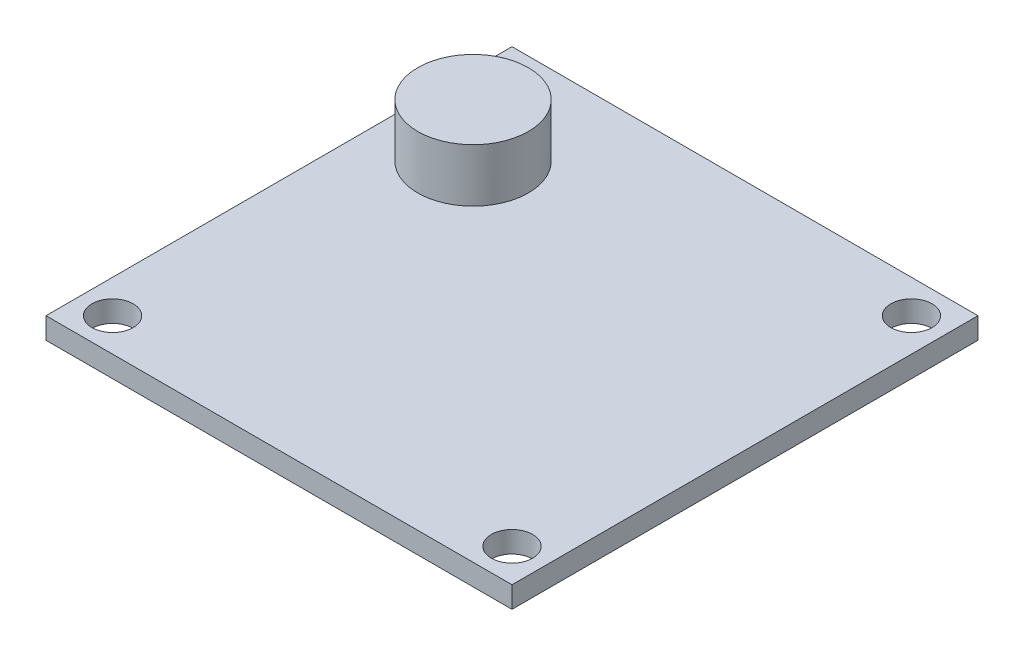
from build123d import *

# Parameters (mm, degrees)
SKETCH1_W           = 35
SKETCH1_H           = 35
SKETCH1_R           = 1.55
BOSS_EXTRUDE1_DEPTH = 1.6
SKETCH2_R           = 4.154250073
BOSS_EXTRUDE2_DEPTH = 4


with BuildPart() as part:
    # Sketch1 → Boss-Extrude1 (new body)
    with BuildSketch(Plane(origin=(0, 0, 0), x_dir=(1, 0, 0), z_dir=(0, 1, 0))):
        Rectangle(SKETCH1_W, SKETCH1_H)
        with Locations(Location((-15, 15, 0), (0, 0, 270))):
            Circle(SKETCH1_R, mode=Mode.SUBTRACT)
        with Locations(Location((15, 15, 0), (0, 0, 90))):
            Circle(SKETCH1_R, mode=Mode.SUBTRACT)
        with Locations(Location((15, -15, 0), (0, 0, 270))):
            Circle(SKETCH1_R, mode=Mode.SUBTRACT)
        with Locations(Location((-15, -15, 0), (0, 0, 90))):
            Circle(SKETCH1_R, mode=Mode.SUBTRACT)
    extrude(amount=BOSS_EXTRUDE1_DEPTH)

    # Sketch2 → Boss-Extrude2 (add)
    with BuildSketch(Plane(origin=(0, 1.6, 0), x_dir=(1, 0, 0), z_dir=(0, 1, 0))):
        with Locations(Location((-11.521184777, 8.595529588, 0), (0, 0, 90))):
            Circle(SKETCH2_R)
    extrude(amount=BOSS_EXTRUDE2_DEPTH)


solid = part.part
